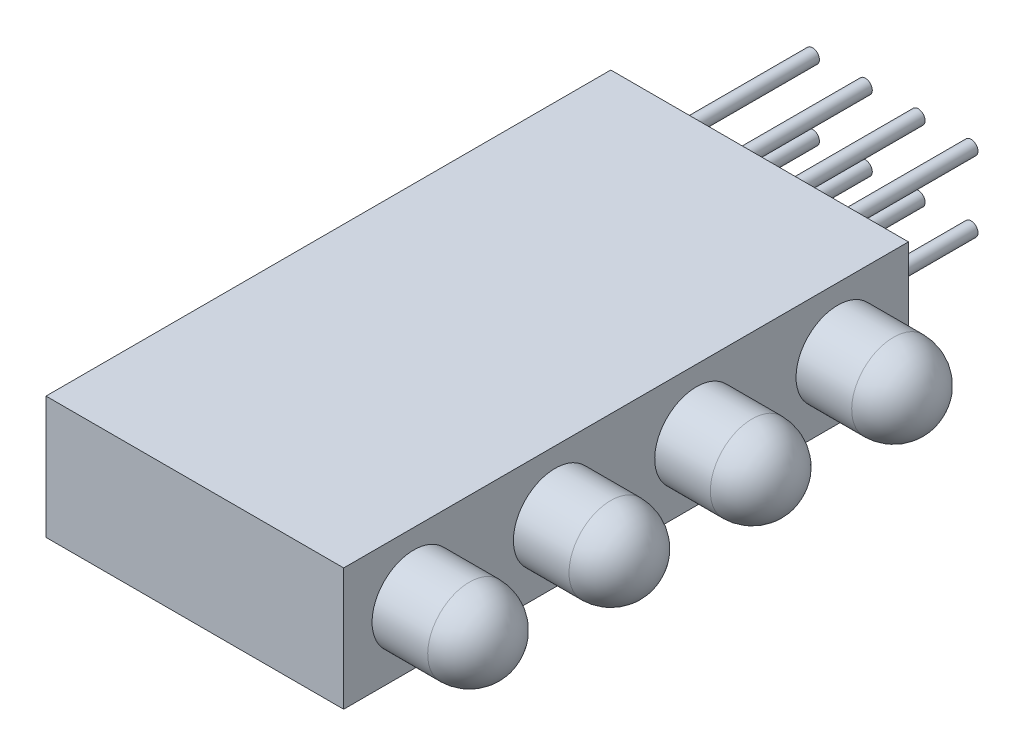
from build123d import *

# Parameters (mm, degrees)
SKETCH_1_W      = 10.7
SKETCH_1_H      = 4.4
EXTRUDE_1_DEPTH = 20.3
SKETCH_2_R      = 0.25
EXTRUDE_2_DEPTH = 5
SKETCH_3_R      = 1.5
EXTRUDE_3_DEPTH = 3.5
FILLET_1_R      = 1.5


with BuildPart() as part:
    # 草图1 → 凸台-拉伸1 (new body)
    with BuildSketch(Plane.XY):
        Rectangle(SKETCH_1_W, SKETCH_1_H)
    extrude(amount=EXTRUDE_1_DEPTH)

    # 草图2 → 凸台-拉伸2 (add)
    with BuildSketch(Plane(origin=(0, 0, 0), x_dir=(-1, 0, 0), z_dir=(0, 0, -1))):
        with Locations(Location((-2.6, 1.27, 0), (0, 0, 180))):
            Circle(SKETCH_2_R)
        with Locations(Location((-0.7, 1.27, 0), (0, 0, 180))):
            Circle(SKETCH_2_R)
        with Locations(Location((1.2, 1.27, 0), (0, 0, 180))):
            Circle(SKETCH_2_R)
        with Locations(Location((3.1, 1.27, 0), (0, 0, 180))):
            Circle(SKETCH_2_R)
        with Locations(Location((3.1, -1.27, 0), (0, 0, 180))):
            Circle(SKETCH_2_R)
        with Locations(Location((1.2, -1.27, 0), (0, 0, 180))):
            Circle(SKETCH_2_R)
        with Locations(Location((-0.7, -1.27, 0), (0, 0, 180))):
            Circle(SKETCH_2_R)
        with Locations(Location((-2.6, -1.27, 0), (0, 0, 180))):
            Circle(SKETCH_2_R)
    extrude(amount=EXTRUDE_2_DEPTH)

    # 草图3 → 凸台-拉伸3 (add)
    with BuildSketch(Plane(origin=(5.35, 0, 0), x_dir=(0, 0, -1), z_dir=(1, 0, 0))):
        with Locations(Location((-2.54, 0, 0), (0, 0, 270))):
            Circle(SKETCH_3_R)
        with Locations(Location((-7.62, 0, 0), (0, 0, 270))):
            Circle(SKETCH_3_R)
        with Locations(Location((-12.7, 0, 0), (0, 0, 270))):
            Circle(SKETCH_3_R)
        with Locations(Location((-17.78, 0, 0), (0, 0, 270))):
            Circle(SKETCH_3_R)
    extrude(amount=EXTRUDE_3_DEPTH)

    # 圆角1
    fillet_1_edges = [part.edges().sort_by_distance(p)[0] for p in [
        (8.85, 1.5, 2.54),
        (8.85, 1.5, 7.62),
        (8.85, 1.5, 12.7),
        (8.85, 1.5, 17.78),
    ]]
    fillet(fillet_1_edges, radius=FILLET_1_R)


solid = part.part
